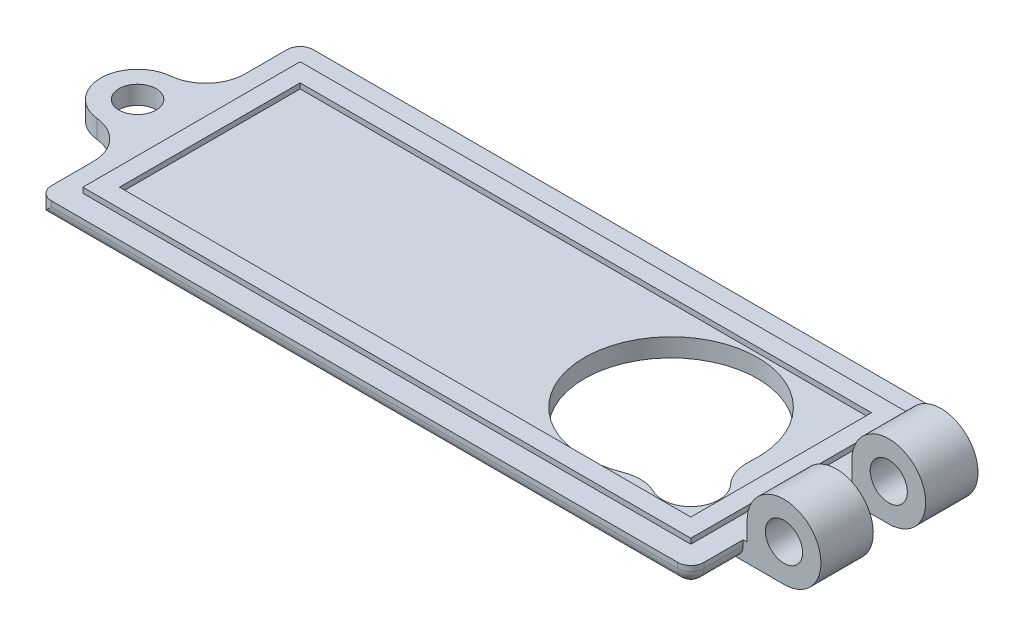
from build123d import *

# Parameters (mm, degrees)
SKETCH1_W               = 63.2968
SKETCH1_H               = 25.4
BOSS_EXTRUDE1_DEPTH     = 1.778
SKETCH2_W               = 58.9788
SKETCH2_H               = 21.082
SKETCH2_W_2             = 55.4228
SKETCH2_H_2             = 17.526
BOSS_EXTRUDE2_DEPTH     = 0.508
CUT_EXTRUDE1_DEPTH      = 69.241268205
SKETCH4_R               = 1.8034
BOSS_EXTRUDE3_DEPTH     = 25.4
CUT_EXTRUDE2_DEPTH      = 76.448967385
CUT_EXTRUDE2_DEPTH_BACK = 76.448967385
SKETCH5_W               = 7.5438
SKETCH5_H               = 5.08
SKETCH6_R               = 1.8034
BOSS_EXTRUDE4_DEPTH     = 1.778
FILLET1_R               = 3.81
FILLET2_R               = 1.27


with BuildPart() as part:
    # Sketch1 → Boss-Extrude1 (new body)
    with BuildSketch(Plane(origin=(0, 0, 0), x_dir=(1, 0, 0), z_dir=(0, 1, 0))):
        with Locations((31.6484, 12.7)):
            Rectangle(SKETCH1_W, SKETCH1_H)
    extrude(amount=BOSS_EXTRUDE1_DEPTH)

    # Sketch2 → Boss-Extrude2 (add)
    with BuildSketch(Plane(origin=(0, 1.778, 0), x_dir=(1, 0, 0), z_dir=(0, 1, 0))):
        with Locations((31.6484, 12.7)):
            Rectangle(SKETCH2_W, SKETCH2_H)
        with Locations((31.6484, 12.7)):
            Rectangle(SKETCH2_W_2, SKETCH2_H_2, mode=Mode.SUBTRACT)
    extrude(amount=BOSS_EXTRUDE2_DEPTH)

    # Sketch3 → Cut-Extrude1 (cut, through all)
    with BuildSketch(Plane.XZ):
        with BuildLine():
            ThreePointArc((51.787849097, -4.902137014), (41.929975763, -17.692024651), (57.045417104, -12.010270916))
            ThreePointArc((57.045417104, -12.010270916), (57.241266983, -10.453460929), (58.047912797, -9.107601708))
            ThreePointArc((58.047912797, -9.107601708), (58.24035221, -5.627970348), (54.856830108, -4.793317419))
            ThreePointArc((54.856830108, -4.793317419), (53.333788817, -5.170623315), (51.787849097, -4.902137014))
        make_face()
    extrude(amount=-CUT_EXTRUDE1_DEPTH, mode=Mode.SUBTRACT)

    # Sketch4 → Boss-Extrude3 (add)
    with BuildSketch(Plane.XY):
        with BuildLine():
            Line((63.2968, 0), (67.2592, 0))
            ThreePointArc((67.2592, 0), (69.791632226, 6.113832226), (63.6778, 3.5814))
            Line((63.6778, 3.5814), (63.6778, 1.778))
            Line((63.6778, 1.778), (63.2968, 1.778))
            Line((63.2968, 1.778), (63.2968, 0))
        make_face()
        with Locations((67.2592, 3.5814)):
            Circle(SKETCH4_R, mode=Mode.SUBTRACT)
    extrude(amount=-BOSS_EXTRUDE3_DEPTH)

    # Sketch5 → Cut-Extrude2 (cut, two sides: drawn at the far end of the back side and taken through both)
    with BuildSketch(Plane(origin=(0, 1.778, 0), x_dir=(1, 0, 0), z_dir=(0, 1, 0)).offset(-CUT_EXTRUDE2_DEPTH_BACK)):
        with Locations((67.0687, 22.86)):
            Rectangle(SKETCH5_W, SKETCH5_H)
        with Locations((67.0687, 12.7)):
            Rectangle(SKETCH5_W, SKETCH5_H)
        with Locations((67.0687, 2.54)):
            Rectangle(SKETCH5_W, SKETCH5_H)
    extrude(amount=CUT_EXTRUDE2_DEPTH + CUT_EXTRUDE2_DEPTH_BACK, mode=Mode.SUBTRACT)

    # Sketch6 → Boss-Extrude4 (add)
    with BuildSketch(Plane(origin=(0, 1.778, 0), x_dir=(1, 0, 0), z_dir=(0, 1, 0))):
        with BuildLine():
            Line((0, 16.2814), (0, 9.1186))
            Line((0, 9.1186), (-3.0734, 9.1186))
            ThreePointArc((-3.0734, 9.1186), (-6.6548, 12.7), (-3.0734, 16.2814))
            Line((-3.0734, 16.2814), (0, 16.2814))
        make_face()
        with Locations(Location((-3.0734, 12.7, 0), (0, 0, 270))):
            Circle(SKETCH6_R, mode=Mode.SUBTRACT)
    extrude(amount=-BOSS_EXTRUDE4_DEPTH)

    # Fillet1
    fillet1_edges = [part.edges().sort_by_distance(p)[0] for p in [
        (0, 0.889, -9.1186),
        (0, 0.889, -16.2814),
    ]]
    fillet(fillet1_edges, radius=FILLET1_R)

    # Fillet2
    fillet2_edges = [part.edges().sort_by_distance(p)[0] for p in [
        (63.2968, 0, -22.86),
        (63.2968, 0.889, -25.4),
        (63.2968, 0, -12.7),
        (63.2968, 0.889, 0),
        (63.2968, 0, -2.54),
        (31.6484, 0, 0),
        (0, 0.889, -25.4),
        (0, 0.889, 0),
        (31.6484, 0, -25.4),
    ]]
    fillet(fillet2_edges, radius=FILLET2_R)


solid = part.part
